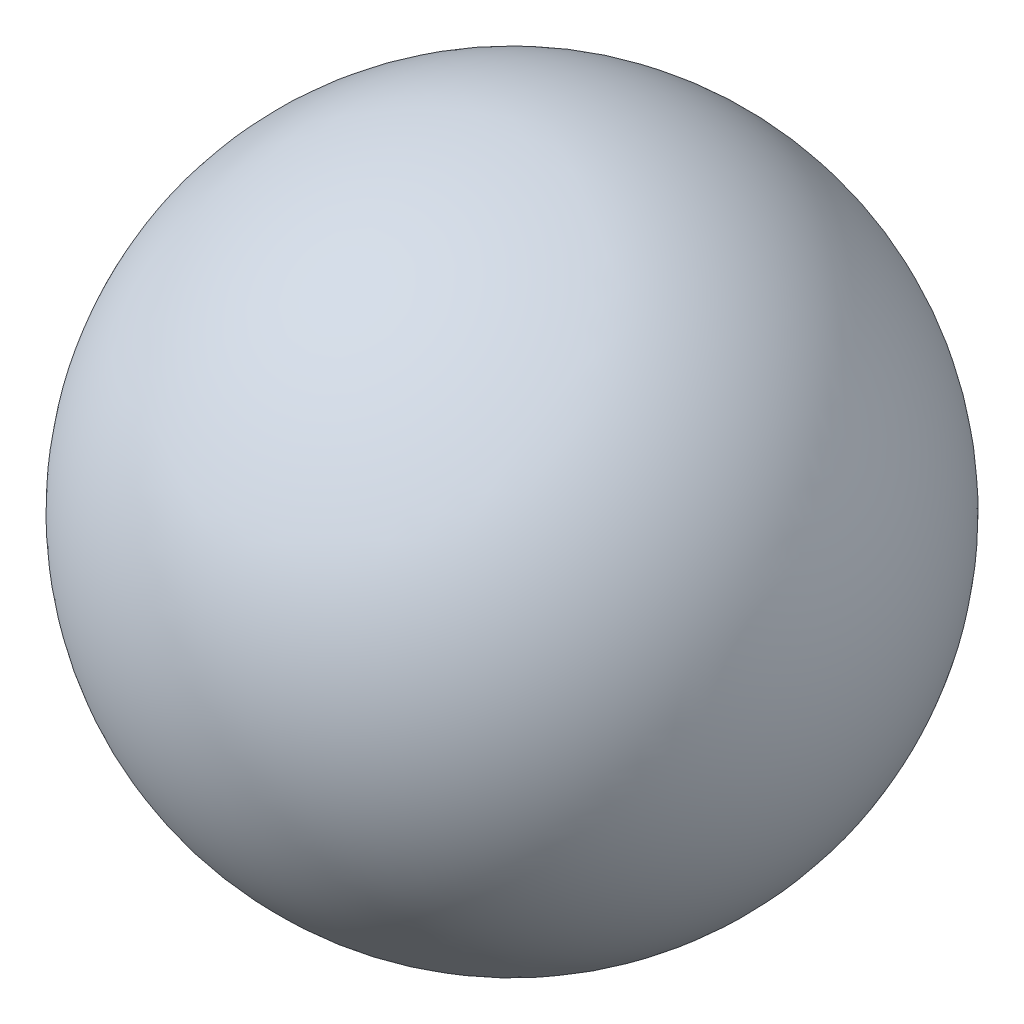
from build123d import *


with BuildPart() as part:
    # Esquisse1 → Base-Révolution (revolve)
    with BuildSketch(Plane(origin=(0, 0, 0), x_dir=(1, 0, 0), z_dir=(0, 1, 0))):
        with BuildLine():
            Line((1.3, 3.7), (6.1, 3.7))
            ThreePointArc((6.1, 3.7), (3.7, 6.1), (1.3, 3.7))
        make_face()
    revolve(axis=Axis((-0.3, 0, -3.7), (1, 0, 0)))


solid = part.part
